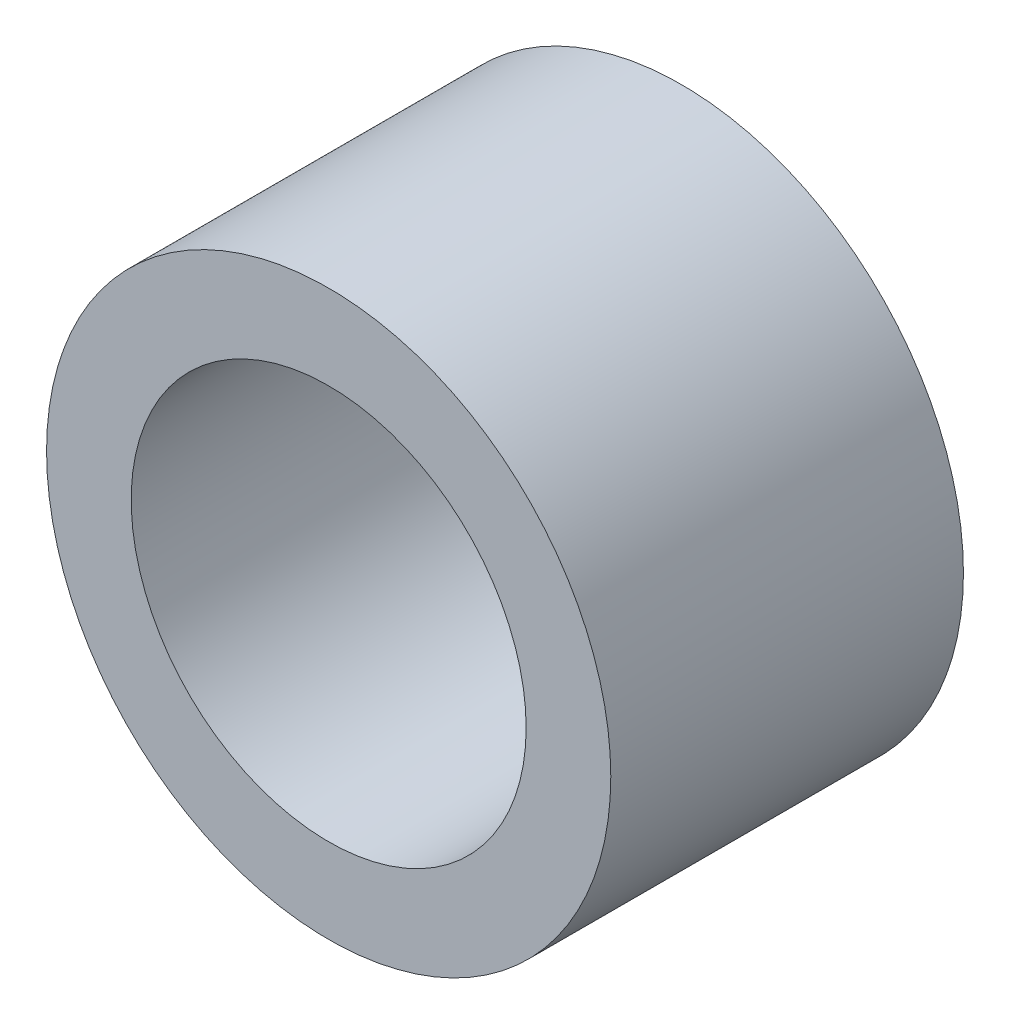
from build123d import *

# Parameters (mm, degrees)
SKETCH1_R           = 5.08
SKETCH1_R_2         = 3.556
BOSS_EXTRUDE1_DEPTH = 3.175


with BuildPart() as part:
    # Sketch1 → Boss-Extrude1 (new, symmetric)
    with BuildSketch(Plane.XY):
        Circle(SKETCH1_R)
        Circle(SKETCH1_R_2, mode=Mode.SUBTRACT)
    extrude(amount=BOSS_EXTRUDE1_DEPTH, both=True)


solid = part.part
